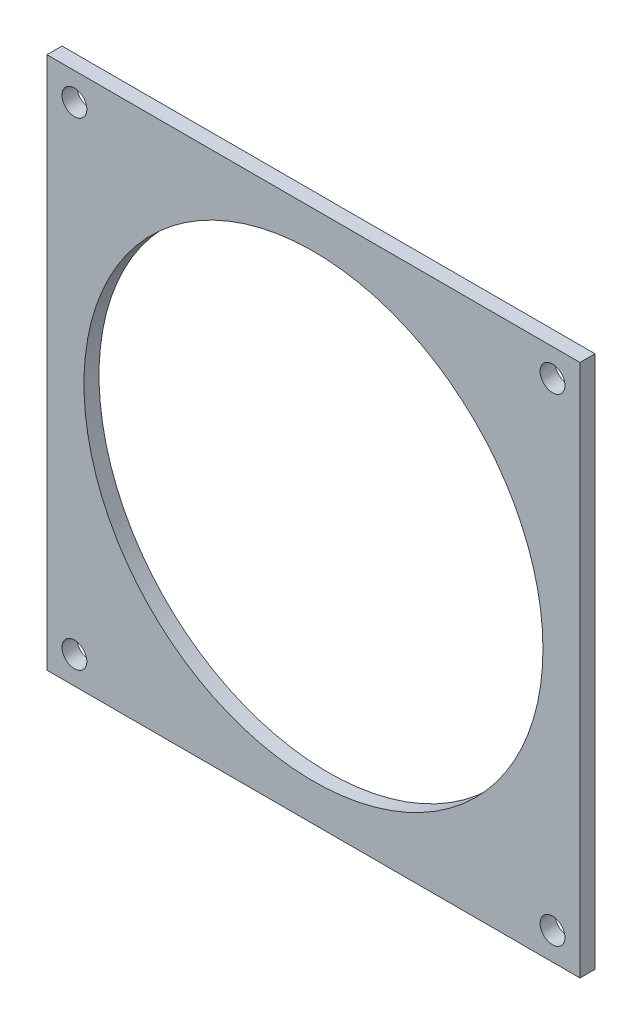
from build123d import *

# Parameters (mm, degrees)
SKETCH1_W           = 177
SKETCH1_H           = 177
SKETCH1_R           = 76.2
SKETCH1_R_2         = 4.125
BOSS_EXTRUDE1_DEPTH = 5


with BuildPart() as part:
    # Sketch1 → Boss-Extrude1 (new body)
    # profile 1 of 5: a face of its own
    with BuildSketch(Plane.XY):
        with Locations((88.5, 88.5)):
            Rectangle(SKETCH1_W, SKETCH1_H)
        with Locations((88.5, 88.5)):
            Circle(SKETCH1_R, mode=Mode.SUBTRACT)
        Polygon((163.645909278, 1.8), (159.416818556, 9.125), (163.645909278, 16.45), (172.104090722, 16.45), (176.333181444, 9.125), (172.104090722, 1.8), align=None, mode=Mode.SUBTRACT)
        Polygon((13.354090722, 1.8), (17.583181444, 9.125), (13.354090722, 16.45), (4.895909278, 16.45), (0.666818556, 9.125), (4.895909278, 1.8), align=None, mode=Mode.SUBTRACT)
        Polygon((163.645909278, 160.55), (172.104090722, 160.55), (176.333181444, 167.875), (172.104090722, 175.2), (163.645909278, 175.2), (159.416818556, 167.875), align=None, mode=Mode.SUBTRACT)
        Polygon((17.583181444, 167.875), (13.354090722, 160.55), (4.895909278, 160.55), (0.666818556, 167.875), (4.895909278, 175.2), (13.354090722, 175.2), align=None, mode=Mode.SUBTRACT)
    # profile 2 of 5: a face of its own
    with BuildSketch(Plane.XY):
        Polygon((13.354090722, 160.55), (4.895909278, 160.55), (0.666818556, 167.875), (4.895909278, 175.2), (13.354090722, 175.2), (17.583181444, 167.875), align=None)
        with Locations((9.125, 167.875)):
            Circle(SKETCH1_R_2, mode=Mode.SUBTRACT)
    # profile 3 of 5: a face of its own
    with BuildSketch(Plane.XY):
        Polygon((4.895909278, 1.8), (13.354090722, 1.8), (17.583181444, 9.125), (13.354090722, 16.45), (4.895909278, 16.45), (0.666818556, 9.125), align=None)
        with Locations((9.125, 9.125)):
            Circle(SKETCH1_R_2, mode=Mode.SUBTRACT)
    # profile 4 of 5: a face of its own
    with BuildSketch(Plane.XY):
        Polygon((159.416818556, 9.125), (163.645909278, 16.45), (172.104090722, 16.45), (176.333181444, 9.125), (172.104090722, 1.8), (163.645909278, 1.8), align=None)
        with Locations((167.875, 9.125)):
            Circle(SKETCH1_R_2, mode=Mode.SUBTRACT)
    # profile 5 of 5: a face of its own
    with BuildSketch(Plane.XY):
        Polygon((159.416818556, 167.875), (163.645909278, 160.55), (172.104090722, 160.55), (176.333181444, 167.875), (172.104090722, 175.2), (163.645909278, 175.2), align=None)
        with Locations((167.875, 167.875)):
            Circle(SKETCH1_R_2, mode=Mode.SUBTRACT)
    extrude(amount=BOSS_EXTRUDE1_DEPTH)


solid = part.part
